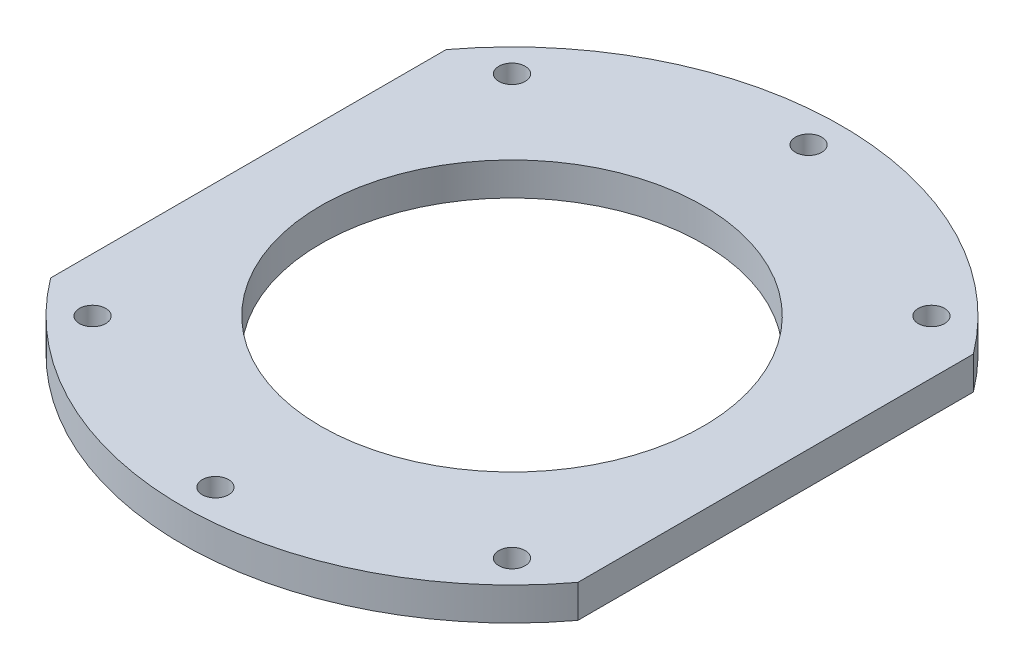
from build123d import *

# Parameters (mm, degrees)
SKETCH_1_R          = 50
SKETCH_1_R_2        = 29
SKETCH_1_R_3        = 2
EXTRUDE_1_DEPTH     = 5
SKETCH_2_W          = 110
SKETCH_2_H          = 158.486135634
SKETCH_2_W_2        = 80
SKETCH_2_H_2        = 128.486135634
CUT_EXTRUDE_1_DEPTH = 10


with BuildPart() as part:
    # 草图1 → 凸台-拉伸1 (new body)
    with BuildSketch(Plane(origin=(0, 0, 0), x_dir=(1, 0, 0), z_dir=(0, 1, 0))):
        with Locations(Location((0, 0, 0), (0, 0, 270))):
            Circle(SKETCH_1_R)
        with Locations(Location((0, 0, 0), (0, 0, 270))):
            Circle(SKETCH_1_R_2, mode=Mode.SUBTRACT)
        with Locations(Location((45, 0, 0), (0, 0, 270))):
            Circle(SKETCH_1_R_3, mode=Mode.SUBTRACT)
        with Locations(Location((31.819805153, -31.819805153, 0), (0, 0, 270))):
            Circle(SKETCH_1_R_3, mode=Mode.SUBTRACT)
        with Locations(Location((0, -45, 0), (0, 0, 270))):
            Circle(SKETCH_1_R_3, mode=Mode.SUBTRACT)
        with Locations(Location((-31.819805153, -31.819805153, 0), (0, 0, 270))):
            Circle(SKETCH_1_R_3, mode=Mode.SUBTRACT)
        with Locations(Location((-45, 0, 0), (0, 0, 270))):
            Circle(SKETCH_1_R_3, mode=Mode.SUBTRACT)
        with Locations(Location((-31.819805153, 31.819805153, 0), (0, 0, 270))):
            Circle(SKETCH_1_R_3, mode=Mode.SUBTRACT)
        with Locations(Location((0, 45, 0), (0, 0, 270))):
            Circle(SKETCH_1_R_3, mode=Mode.SUBTRACT)
        with Locations(Location((31.819805153, 31.819805153, 0), (0, 0, 270))):
            Circle(SKETCH_1_R_3, mode=Mode.SUBTRACT)
    extrude(amount=EXTRUDE_1_DEPTH)

    # 草图2 → 切除-拉伸-薄壁1 (cut)
    with BuildSketch(Plane(origin=(0, 5, 0), x_dir=(1, 0, 0), z_dir=(0, 1, 0))):
        Rectangle(SKETCH_2_W, SKETCH_2_H)
        Rectangle(SKETCH_2_W_2, SKETCH_2_H_2, mode=Mode.SUBTRACT)
    extrude(amount=-CUT_EXTRUDE_1_DEPTH, mode=Mode.SUBTRACT)


solid = part.part
